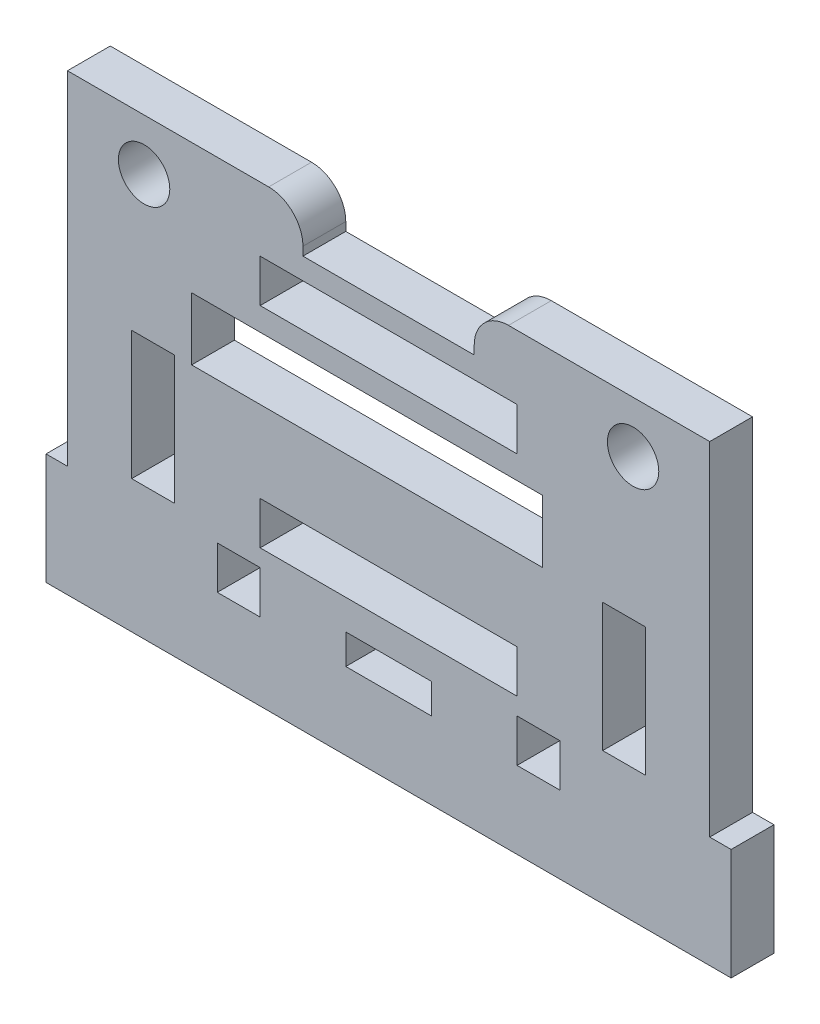
from build123d import *

# Parameters (mm, degrees)
SKETCH_1_R      = 3
SKETCH_1_W      = 30
SKETCH_1_H      = 5
SKETCH_1_W_2    = 5
SKETCH_1_H_2    = 15
SKETCH_1_W_3    = 10
SKETCH_1_H_3    = 3.5
SKETCH_1_W_4    = 41
SKETCH_1_H_4    = 7.3
EXTRUDE_1_DEPTH = 5


with BuildPart() as part:
    # 草图1 → 凸台-拉伸1 (new body)
    with BuildSketch(Plane.XY):
        with BuildLine():
            Line((0, 0), (-80, 0))
            Line((-80, 0), (-80, 13))
            Line((-80, 13), (-77.5, 13))
            Line((-77.5, 13), (-77.5, 53))
            Line((-77.5, 53), (-54, 53))
            ThreePointArc((-54, 53), (-51.171572875, 51.828427125), (-50, 49))
            Line((-50, 49), (-50, 48))
            Line((-50, 48), (-30, 48))
            Line((-30, 48), (-30, 49))
            ThreePointArc((-30, 49), (-28.828427125, 51.828427125), (-26, 53))
            Line((-26, 53), (-2.5, 53))
            Line((-2.5, 53), (-2.5, 13))
            Line((-2.5, 13), (0, 13))
            Line((0, 13), (0, 0))
        make_face()
        with Locations((-68.55, 47)):
            Circle(SKETCH_1_R, mode=Mode.SUBTRACT)
        with Locations((-11.45, 47)):
            Circle(SKETCH_1_R, mode=Mode.SUBTRACT)
        with Locations((-40, 43)):
            Rectangle(SKETCH_1_W, SKETCH_1_H, mode=Mode.SUBTRACT)
        with Locations((-67.5, 23)):
            Rectangle(SKETCH_1_W_2, SKETCH_1_H_2, mode=Mode.SUBTRACT)
        with Locations((-12.5, 23)):
            Rectangle(SKETCH_1_W_2, SKETCH_1_H_2, mode=Mode.SUBTRACT)
        Polygon((-55, 16), (-50, 16), (-30, 16), (-25, 16), (-25, 21), (-55, 21), align=None, mode=Mode.SUBTRACT)
        with Locations((-57.5, 11.5)):
            Rectangle(SKETCH_1_W_2, SKETCH_1_H, mode=Mode.SUBTRACT)
        with Locations((-22.5, 11.5)):
            Rectangle(SKETCH_1_W_2, SKETCH_1_H, mode=Mode.SUBTRACT)
        with Locations((-40, 10.75)):
            Rectangle(SKETCH_1_W_3, SKETCH_1_H_3, mode=Mode.SUBTRACT)
        with Locations((-42.5, 34.15)):
            Rectangle(SKETCH_1_W_4, SKETCH_1_H_4, mode=Mode.SUBTRACT)
    extrude(amount=EXTRUDE_1_DEPTH)


solid = part.part
